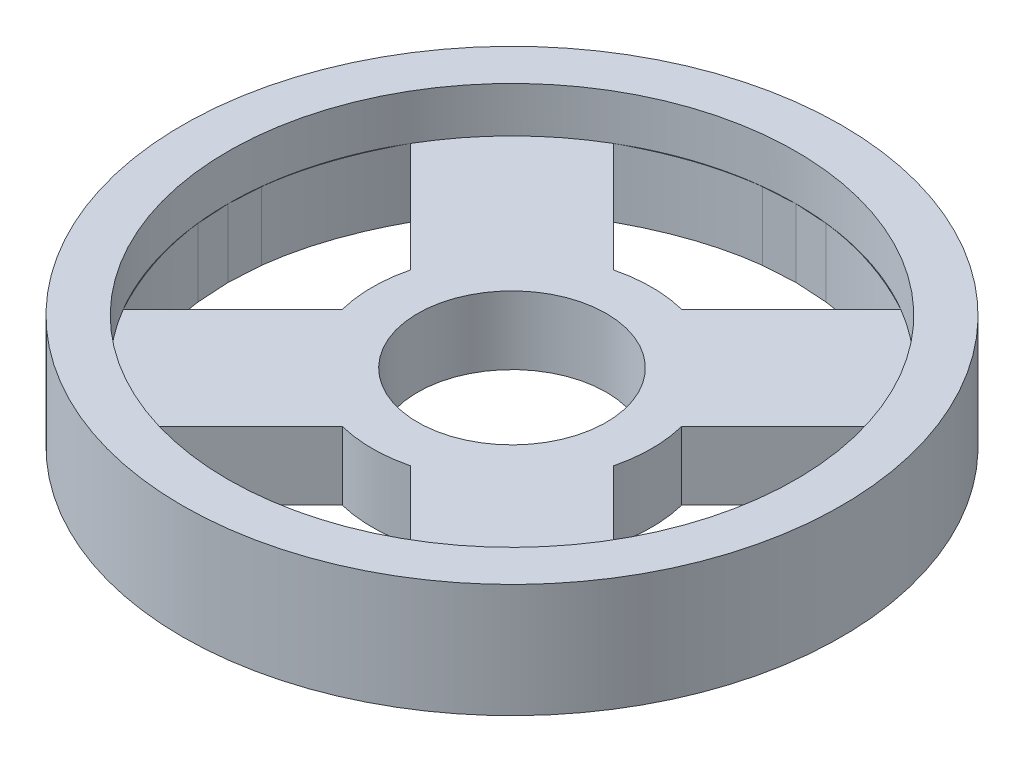
from build123d import *

# Parameters (mm, degrees)
SKETCH1_R           = 14.5
SKETCH1_R_2         = 12.5
BOSS_EXTRUDE1_DEPTH = 5
SKETCH1_2_R         = 12.5
BOSS_EXTRUDE2_DEPTH = 3
SKETCH2_R           = 4.15
CUT_EXTRUDE1_DEPTH  = 3


with BuildPart() as part:
    # Sketch1 → Boss-Extrude1 (new body)
    with BuildSketch(Plane(origin=(0, 0, 0), x_dir=(1, 0, 0), z_dir=(0, 1, 0))):
        with Locations(Location((0.707186418, -0.325776571, 0), (0, 0, 270))):
            Circle(SKETCH1_R)
        with Locations(Location((0.707186418, -0.325776571, 0), (0, 0, 270))):
            Circle(SKETCH1_R_2, mode=Mode.SUBTRACT)
    extrude(amount=BOSS_EXTRUDE1_DEPTH)

    # Sketch1<2> → Boss-Extrude2 (add)
    with BuildSketch(Plane(origin=(0, 0, 0), x_dir=(1, 0, 0), z_dir=(0, 1, 0))):
        with Locations(Location((0.707186418, -0.325776571, 0), (0, 0, 270))):
            Circle(SKETCH1_2_R)
    extrude(amount=BOSS_EXTRUDE2_DEPTH)

    # Sketch2 → Cut-Extrude1 (cut)
    with BuildSketch(Plane.XZ):
        with BuildLine():
            Line((-11.69653572, 1.823074137), (-5.257761193, 1.823074137))
            Line((-5.257761193, 1.823074137), (-10.078540485, 6.643853429))
            add(Edge.make_bspline(
                [(-10.078540485, 6.643853429), (-11.386554368, 4.233463783), (-11.69653572, 1.823074137)],
                knots=[0, 0, 0, 0.381506857, 0.381506857, 0.381506857], degree=2))
        make_face()
        with BuildLine():
            Line((-10.078540485, -5.992300287), (-5.257761193, -1.171520995))
            Line((-5.257761193, -1.171520995), (-11.69653572, -1.171520995))
            add(Edge.make_bspline(
                [(-11.69653572, -1.171520995), (-11.386554368, -3.581910641), (-10.078540485, -5.992300287)],
                knots=[0.618493143, 0.618493143, 0.618493143, 1, 1, 1], degree=2))
        make_face()
        with BuildLine():
            ThreePointArc((-5.257761193, -1.171520995), (-5.396375157, -0.428568242), (-5.442813582, 0.325776571))
            Line((-5.442813582, 0.325776571), (-11.792813582, 0.325776571))
            Line((-11.792813582, 0.325776571), (-11.708682092, -1.073888712))
            add(Edge.make_bspline(
                [(-11.708682092, -1.073888712), (-11.702813582, -1.122704853), (-11.69653572, -1.171520995)],
                knots=[0.610766719, 0.610766719, 0.610766719, 0.618493143, 0.618493143, 0.618493143], degree=2))
            Line((-11.69653572, -1.171520995), (-5.257761193, -1.171520995))
        make_face()
        with BuildLine():
            ThreePointArc((-5.442813582, 0.325776571), (-5.396375157, 1.080121384), (-5.257761193, 1.823074137))
            Line((-5.257761193, 1.823074137), (-11.69653572, 1.823074137))
            add(Edge.make_bspline(
                [(-11.69653572, 1.823074137), (-11.702813582, 1.774257995), (-11.708682092, 1.725441854)],
                knots=[0.381506857, 0.381506857, 0.381506857, 0.389233281, 0.389233281, 0.389233281], degree=2))
            Line((-11.708682092, 1.725441854), (-11.792813582, 0.325776571))
            Line((-11.792813582, 0.325776571), (-5.442813582, 0.325776571))
        make_face()
        with BuildLine():
            Line((-0.790111147, -12.077945567), (-0.790111147, -5.63917104))
            Line((-0.790111147, -5.63917104), (-5.610890439, -10.459950332))
            add(Edge.make_bspline(
                [(-5.610890439, -10.459950332), (-3.200500793, -11.767964215), (-0.790111147, -12.077945567)],
                knots=[0, 0, 0, 0.381506857, 0.381506857, 0.381506857], degree=2))
        make_face()
        with BuildLine():
            ThreePointArc((0.707186418, -5.824223429), (-0.047158395, -5.777785004), (-0.790111147, -5.63917104))
            Line((-0.790111147, -5.63917104), (-0.790111147, -12.077945567))
            add(Edge.make_bspline(
                [(-0.790111147, -12.077945567), (-0.741295006, -12.084223429), (-0.692478865, -12.090091939)],
                knots=[0.381506857, 0.381506857, 0.381506857, 0.389233281, 0.389233281, 0.389233281], degree=2))
            Line((-0.692478865, -12.090091939), (0.707186418, -12.174223429))
            Line((0.707186418, -12.174223429), (0.707186418, -5.824223429))
        make_face()
        with BuildLine():
            Line((2.204483984, -12.077945567), (2.204483984, -5.63917104))
            ThreePointArc((2.204483984, -5.63917104), (1.461531231, -5.777785004), (0.707186418, -5.824223429))
            Line((0.707186418, -5.824223429), (0.707186418, -12.174223429))
            Line((0.707186418, -12.174223429), (2.106851701, -12.090091939))
            add(Edge.make_bspline(
                [(2.106851701, -12.090091939), (2.155667843, -12.084223429), (2.204483984, -12.077945567)],
                knots=[0.610766719, 0.610766719, 0.610766719, 0.618493143, 0.618493143, 0.618493143], degree=2))
        make_face()
        with BuildLine():
            Line((7.025263276, -10.459950332), (2.204483984, -5.63917104))
            Line((2.204483984, -5.63917104), (2.204483984, -12.077945567))
            add(Edge.make_bspline(
                [(2.204483984, -12.077945567), (4.61487363, -11.767964215), (7.025263276, -10.459950332)],
                knots=[0.618493143, 0.618493143, 0.618493143, 1, 1, 1], degree=2))
        make_face()
        with BuildLine():
            Line((13.207186418, 0.325776571), (6.857186418, 0.325776571))
            ThreePointArc((6.857186418, 0.325776571), (6.810747993, -0.428568242), (6.672134029, -1.171520995))
            Line((6.672134029, -1.171520995), (13.110908556, -1.171520995))
            add(Edge.make_bspline(
                [(13.123054928, -1.073888712), (13.117186418, -1.122704853), (13.110908556, -1.171520995)],
                knots=[0.610766719, 0.610766719, 0.610766719, 0.618493143, 0.618493143, 0.618493143], degree=2))
            Line((13.123054928, -1.073888712), (13.207186418, 0.325776571))
        make_face()
        with BuildLine():
            Line((13.110908556, 1.823074137), (6.672134029, 1.823074137))
            ThreePointArc((6.672134029, 1.823074137), (6.810747993, 1.080121384), (6.857186418, 0.325776571))
            Line((6.857186418, 0.325776571), (13.207186418, 0.325776571))
            Line((13.207186418, 0.325776571), (13.123054928, 1.725441854))
            add(Edge.make_bspline(
                [(13.110908556, 1.823074137), (13.117186418, 1.774257995), (13.123054928, 1.725441854)],
                knots=[0.381506857, 0.381506857, 0.381506857, 0.389233281, 0.389233281, 0.389233281], degree=2))
        make_face()
        with BuildLine():
            Line((11.492913321, 6.643853429), (6.672134029, 1.823074137))
            Line((6.672134029, 1.823074137), (13.110908556, 1.823074137))
            add(Edge.make_bspline(
                [(11.492913321, 6.643853429), (12.800927205, 4.233463783), (13.110908556, 1.823074137)],
                knots=[0, 0, 0, 0.381506857, 0.381506857, 0.381506857], degree=2))
        make_face()
        with BuildLine():
            Line((13.110908556, -1.171520995), (6.672134029, -1.171520995))
            Line((6.672134029, -1.171520995), (11.492913321, -5.992300287))
            add(Edge.make_bspline(
                [(13.110908556, -1.171520995), (12.800927205, -3.581910641), (11.492913321, -5.992300287)],
                knots=[0.618493143, 0.618493143, 0.618493143, 1, 1, 1], degree=2))
        make_face()
        with BuildLine():
            Line((2.204483984, 12.729498709), (2.204483984, 6.290724182))
            Line((2.204483984, 6.290724182), (7.025263276, 11.111503474))
            add(Edge.make_bspline(
                [(2.204483984, 12.729498709), (4.61487363, 12.419517357), (7.025263276, 11.111503474)],
                knots=[0.618493143, 0.618493143, 0.618493143, 1, 1, 1], degree=2))
        make_face()
        with BuildLine():
            Line((0.707186418, 12.825776571), (0.707186418, 6.475776571))
            ThreePointArc((0.707186418, 6.475776571), (1.461531231, 6.429338146), (2.204483984, 6.290724182))
            Line((2.204483984, 6.290724182), (2.204483984, 12.729498709))
            add(Edge.make_bspline(
                [(2.106851701, 12.741645081), (2.155667843, 12.735776571), (2.204483984, 12.729498709)],
                knots=[0.610766719, 0.610766719, 0.610766719, 0.618493143, 0.618493143, 0.618493143], degree=2))
            Line((2.106851701, 12.741645081), (0.707186418, 12.825776571))
        make_face()
        with BuildLine():
            ThreePointArc((-0.790111147, 6.290724182), (-0.047158395, 6.429338146), (0.707186418, 6.475776571))
            Line((0.707186418, 6.475776571), (0.707186418, 12.825776571))
            Line((0.707186418, 12.825776571), (-0.692478865, 12.741645081))
            add(Edge.make_bspline(
                [(-0.790111147, 12.729498709), (-0.741295006, 12.735776571), (-0.692478865, 12.741645081)],
                knots=[0.381506857, 0.381506857, 0.381506857, 0.389233281, 0.389233281, 0.389233281], degree=2))
            Line((-0.790111147, 12.729498709), (-0.790111147, 6.290724182))
        make_face()
        with BuildLine():
            Line((-5.610890439, 11.111503474), (-0.790111147, 6.290724182))
            Line((-0.790111147, 6.290724182), (-0.790111147, 12.729498709))
            add(Edge.make_bspline(
                [(-5.610890439, 11.111503474), (-3.200500793, 12.419517357), (-0.790111147, 12.729498709)],
                knots=[0, 0, 0, 0.381506857, 0.381506857, 0.381506857], degree=2))
        make_face()
        with Locations(Location((0.707186418, 0.325776571, 0), (0, 0, 270))):
            Circle(SKETCH2_R)
    extrude(amount=-CUT_EXTRUDE1_DEPTH, mode=Mode.SUBTRACT)


solid = part.part
